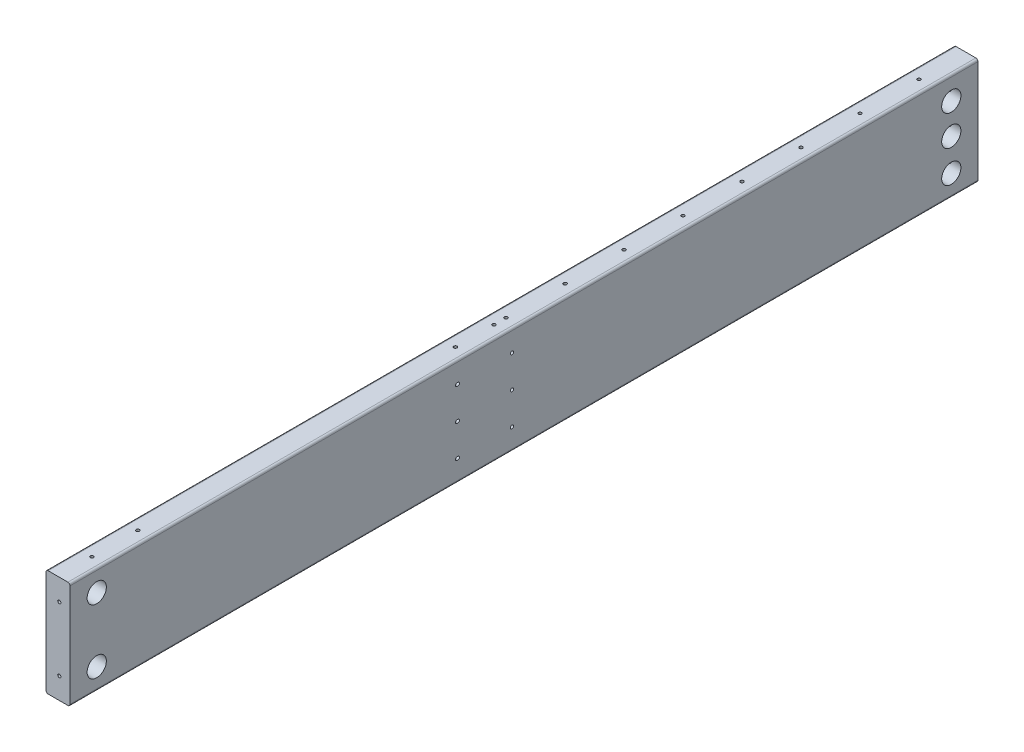
from build123d import *

# Parameters (mm, degrees)
SKETCH1_W                       = 45
SKETCH1_H                       = 200
BOSS_EXTRUDE1_DEPTH             = 1700
FILLET1_R                       = 4
F_6_0MM_DOWEL_SLOT1_D           = 6
F_6_0MM_DOWEL_SLOT1_DEPTH       = 128.197418143
F_6_0MM_DOWEL_SLOT1_CSINK_D     = 6.05
F_6_0MM_DOWEL_SLOT1_CSINK_ANGLE = 90
F_6_0MM_DOWEL_SLOT1_TIP         = 1.802581857
SKETCH17_R                      = 18
CUT_EXTRUDE8_DEPTH              = 30
F_6_0MM_DOWEL_SLOT3_D           = 6
F_6_0MM_DOWEL_SLOT3_DEPTH       = 63.197418143
F_6_0MM_DOWEL_SLOT3_CSINK_D     = 6.05
F_6_0MM_DOWEL_SLOT3_CSINK_ANGLE = 90
F_6_0MM_DOWEL_SLOT3_TIP         = 1.802581857
F_6_0MM_DOWEL_SLOT4_D           = 6
F_6_0MM_DOWEL_SLOT4_DEPTH       = 48.197418143
F_6_0MM_DOWEL_SLOT4_CSINK_D     = 6.05
F_6_0MM_DOWEL_SLOT4_CSINK_ANGLE = 90
F_6_0MM_DOWEL_SLOT4_TIP         = 1.802581857
SKETCH22_R                      = 18
CUT_EXTRUDE9_DEPTH              = 30
F_8_0MM_DOWEL_SLOT3_D           = 8
F_8_0MM_DOWEL_SLOT3_DEPTH       = 137.596557524
F_8_0MM_DOWEL_SLOT3_CSINK_D     = 8.05
F_8_0MM_DOWEL_SLOT3_CSINK_ANGLE = 90
F_8_0MM_DOWEL_SLOT3_TIP         = 2.403442476
F_6_0MM_DOWEL_SLOT8_D           = 6
F_6_0MM_DOWEL_SLOT8_DEPTH       = 28.197418143
F_6_0MM_DOWEL_SLOT8_CSINK_D     = 6.05
F_6_0MM_DOWEL_SLOT8_CSINK_ANGLE = 90
F_6_0MM_DOWEL_SLOT8_TIP         = 1.802581857


with BuildPart() as part:
    # Sketch1 → Boss-Extrude1 (new body)
    with BuildSketch(Plane.XY):
        with Locations((-8.688255411, 34.272684877)):
            Rectangle(SKETCH1_W, SKETCH1_H)
    extrude(amount=BOSS_EXTRUDE1_DEPTH)

    # Fillet1
    fillet1_edges = [part.edges().sort_by_distance(p)[0] for p in [
        (13.811744589, 134.272684877, 850),
        (13.811744589, -65.727315123, 850),
        (-31.188255411, -65.727315123, 850),
        (-31.188255411, 134.272684877, 850),
    ]]
    fillet(fillet1_edges, radius=FILLET1_R)

    # Ø6.0mm Dowel Slot1
    with Locations(Plane(origin=(495.936786729, -65.727315123, 442.277224535), x_dir=(0.6427592920058945, -7.13765947743485e-15, -0.7660682035824756), z_dir=(0.7660682035824756, -8.506969936751697e-15, 0.6427592920058945))):
        with Locations((-717.573535848, 40), (-343.837284168, -87.348590076), (-717.573535848, 100), (-645.06893427, -63.697919268), (-717.573535848, 160)):
            CounterSinkHole(F_6_0MM_DOWEL_SLOT1_D / 2, F_6_0MM_DOWEL_SLOT1_CSINK_D / 2, depth=F_6_0MM_DOWEL_SLOT1_DEPTH, counter_sink_angle=F_6_0MM_DOWEL_SLOT1_CSINK_ANGLE)
            with Locations((0, 0, -(F_6_0MM_DOWEL_SLOT1_DEPTH + F_6_0MM_DOWEL_SLOT1_TIP / 2))):  # 118° drill point
                Cone(0, F_6_0MM_DOWEL_SLOT1_D / 2, F_6_0MM_DOWEL_SLOT1_TIP, mode=Mode.SUBTRACT)

    # Sketch17 → Cut-Extrude8 (cut)
    with BuildSketch(Plane(origin=(13.811744589, 0, 0), x_dir=(0, 0, -1), z_dir=(1, 0, 0))):
        with Locations((-50, -25.727315123)):
            Circle(SKETCH17_R)
        with Locations((-50, 34.272684877)):
            Circle(SKETCH17_R)
        with Locations((-50, 91.272684877)):
            Circle(SKETCH17_R)
    extrude(amount=-CUT_EXTRUDE8_DEPTH, mode=Mode.SUBTRACT)

    # Ø6.0mm Dowel Slot3
    with Locations(Plane(origin=(-31.188255411, -65.727315123, 0), x_dir=(0, 0, 1), z_dir=(-1, 0, 0))):
        with Locations((872.5, 160), (872.5, 100), (872.5, 40)):
            CounterSinkHole(F_6_0MM_DOWEL_SLOT3_D / 2, F_6_0MM_DOWEL_SLOT3_CSINK_D / 2, depth=F_6_0MM_DOWEL_SLOT3_DEPTH, counter_sink_angle=F_6_0MM_DOWEL_SLOT3_CSINK_ANGLE)
            with Locations((0, 0, -(F_6_0MM_DOWEL_SLOT3_DEPTH + F_6_0MM_DOWEL_SLOT3_TIP / 2))):  # 118° drill point
                Cone(0, F_6_0MM_DOWEL_SLOT3_D / 2, F_6_0MM_DOWEL_SLOT3_TIP, mode=Mode.SUBTRACT)

    # Ø6.0mm Dowel Slot4
    with Locations(Plane(origin=(-31.188255411, -65.727315123, 1700), x_dir=(1, 0, 0), z_dir=(0, 0, 1))):
        with Locations((25, 160), (25, 40), (800, 160), (800, 40)):
            CounterSinkHole(F_6_0MM_DOWEL_SLOT4_D / 2, F_6_0MM_DOWEL_SLOT4_CSINK_D / 2, depth=F_6_0MM_DOWEL_SLOT4_DEPTH, counter_sink_angle=F_6_0MM_DOWEL_SLOT4_CSINK_ANGLE)
            with Locations((0, 0, -(F_6_0MM_DOWEL_SLOT4_DEPTH + F_6_0MM_DOWEL_SLOT4_TIP / 2))):  # 118° drill point
                Cone(0, F_6_0MM_DOWEL_SLOT4_D / 2, F_6_0MM_DOWEL_SLOT4_TIP, mode=Mode.SUBTRACT)

    # Sketch22 → Cut-Extrude9 (cut)
    with BuildSketch(Plane(origin=(13.811744589, -65.727315123, 0), x_dir=(0, 0, -1), z_dir=(1, 0, 0))):
        with Locations((-1650, 160)):
            Circle(SKETCH22_R)
        with Locations((-1650, 40)):
            Circle(SKETCH22_R)
    extrude(amount=-CUT_EXTRUDE9_DEPTH, mode=Mode.SUBTRACT)

    # Ø8.0mm Dowel Slot3
    with Locations(Plane(origin=(-31.188255411, -65.727315123, -90), x_dir=(-1, 0, 0), z_dir=(0, 0, -1))):
        with Locations((-22.5, 40), (-22.5, 100), (-22.5, 157)):
            CounterSinkHole(F_8_0MM_DOWEL_SLOT3_D / 2, F_8_0MM_DOWEL_SLOT3_CSINK_D / 2, depth=F_8_0MM_DOWEL_SLOT3_DEPTH, counter_sink_angle=F_8_0MM_DOWEL_SLOT3_CSINK_ANGLE)
            with Locations((0, 0, -(F_8_0MM_DOWEL_SLOT3_DEPTH + F_8_0MM_DOWEL_SLOT3_TIP / 2))):  # 118° drill point
                Cone(0, F_8_0MM_DOWEL_SLOT3_D / 2, F_8_0MM_DOWEL_SLOT3_TIP, mode=Mode.SUBTRACT)

    # Ø6.0mm Dowel Slot8
    with Locations(Plane(origin=(-31.188255411, 146.272684877, 0), x_dir=(1, 0, 0), z_dir=(0, 1, 0))):
        with Locations((22.5, 1726.5), (22.5, 1640.5), (802.5, 1726.5), (802.5, 1640.5), (22.5, -955.960621131), (22.5, -1636.5), (802.5, -1462.5), (802.5, -1636.5), (22.5, -1722.5), (802.5, -1722.5), (22.5, -1550.5), (802.5, -640.31), (120, -1722.5), (217.5, -1722.5), (315, -1722.5), (412.5, -1722.5), (510, -1722.5), (607.5, -1722.5), (705, -1722.5), (22.5, -861.25), (22.5, -883.75), (-22.496198074, -917.60220409), (802.5, -861.25), (802.5, -883.75), (847.496198074, -917.60220409), (802.5, -529.84), (22.5, -750.249617159), (-341.005231297, -650.318686522), (1166.005231297, -650.318686522), (-310.084924074, 22.5), (-310.084924074, 67.5), (22.5, 67.5), (22.5, 22.5), (802.5, 67.5), (802.5, 22.5), (1133.730020848, 67.5), (1133.730020848, 22.5), (1166.005231297, 740.318686522), (802.560751791, 973.75), (802.560751791, 951.25), (847.496198074, 1007.60220409), (-22.496198074, 1007.60220409), (22.560751791, 951.25), (-341.005231297, 740.318686522), (22.5, 1812.5), (802.5, 1812.5), (22.5, 1552.5), (802.5, 1552.5), (-102.162023695, -850.748960129), (-181.827849315, -783.895716167), (-261.493674936, -717.042472206), (927.162023695, -850.748960129), (1006.827849315, -783.895716167), (1086.493674936, -717.042472206), (1086.493674936, 807.042472206), (1006.827849315, 873.895716167), (927.162023695, 940.748960129), (-102.162023695, 940.748960129), (-181.827849315, 873.895716167), (-261.493674936, 807.042472206), (-199.224924074, 67.5), (-88.364924074, 67.5), (-199.224924074, 22.5), (-88.364924074, 22.5), (912.010020848, 67.5), (1022.870020848, 67.5), (912.010020848, 22.5), (1022.870020848, 22.5), (120, 67.5), (217.5, 67.5), (315, 67.5), (607.5, 67.5), (705, 67.5), (510, 67.5), (120, 22.5), (217.5, 22.5), (315, 22.5), (510, 22.5), (607.5, 22.5), (705, 22.5), (412.5, 22.5), (22.5, -750.78), (22.5, -640.31), (22.5, -529.84), (22.5, -419.37), (22.5, -308.9), (22.5, -198.43), (22.5, -87.96), (802.5, -750.78), (802.5, -419.37), (802.5, -308.9), (802.5, -198.43), (22.5, 177.97), (22.5, 288.44), (22.5, 398.91), (22.5, 509.38), (22.5, 619.85), (22.5, 730.32), (22.5, 840.79), (802.5, -87.96), (802.5, 177.97), (802.5, 288.44), (120.000330201, 1812.753749877), (217.5, 1812.5), (315, 1812.5), (412.5, 1812.5), (510, 1812.5), (607.5, 1812.5), (705, 1812.5), (120.060751791, 951.25), (217.560751791, 951.25), (315.060751791, 951.25), (412.560751791, 951.25), (510.060751791, 951.25), (607.560751791, 951.25), (705.060751791, 951.25), (656.310751791, 973.75), (558.810751791, 973.75), (461.310751791, 973.75), (363.810751791, 973.75), (266.310751791, 973.75), (168.810751791, 973.75), (120, -861.25), (217.5, -861.25), (315, -861.25), (412.5, -861.25), (510, -861.25), (607.5, -861.25), (705, -861.25), (656.25, -883.75), (558.75, -883.75), (461.25, -883.75), (168.75, -883.75), (266.25, -883.75), (363.75, -883.75), (802.560751791, -955.960621131), (412.5, 67.5), (802.5, 730.32), (802.560751791, 840.79), (802.5, 398.91), (802.5, 509.38), (802.5, 619.85), (-360.000025903, 699.425529794), (-360.000025903, -609.521258848), (-360.000025903, 598.725529794), (-360.000025903, 498.025529794), (-360.000025903, 397.325529794), (-360.000025903, 296.625529794), (-360.000025903, 195.925529794), (-360.000025903, 95.225529794), (-360.000025903, -5.474470206), (-360.000025903, -106.174470206), (-360.000025903, -206.874470206), (-360.000025903, -307.574470206), (-360.000025903, -408.274470206), (-360.000025903, -508.974470206), (1185.00101945, 699.425529452), (1185.000941829, 598.725529794), (1185.000864209, 498.025529794), (1185.000708968, 296.625529794), (1185.000631348, 195.925529794), (1185.000553727, 95.225529794), (1185.000476107, -5.474470206), (1185.000398486, -106.174470206), (1185.000320866, -206.874470206), (1185.000165625, -408.274470206), (1185.000088004, -508.974470206), (1185.000786589, 397.325529794), (22.560751791, 1016.385842825), (802.560751791, 1016.385842825), (802.560751791, -1550.5), (22.560751791, 973.75), (802.560751791, -363.966698641)):
            CounterSinkHole(F_6_0MM_DOWEL_SLOT8_D / 2, F_6_0MM_DOWEL_SLOT8_CSINK_D / 2, depth=F_6_0MM_DOWEL_SLOT8_DEPTH, counter_sink_angle=F_6_0MM_DOWEL_SLOT8_CSINK_ANGLE)
            with Locations((0, 0, -(F_6_0MM_DOWEL_SLOT8_DEPTH + F_6_0MM_DOWEL_SLOT8_TIP / 2))):  # 118° drill point
                Cone(0, F_6_0MM_DOWEL_SLOT8_D / 2, F_6_0MM_DOWEL_SLOT8_TIP, mode=Mode.SUBTRACT)


solid = part.part
